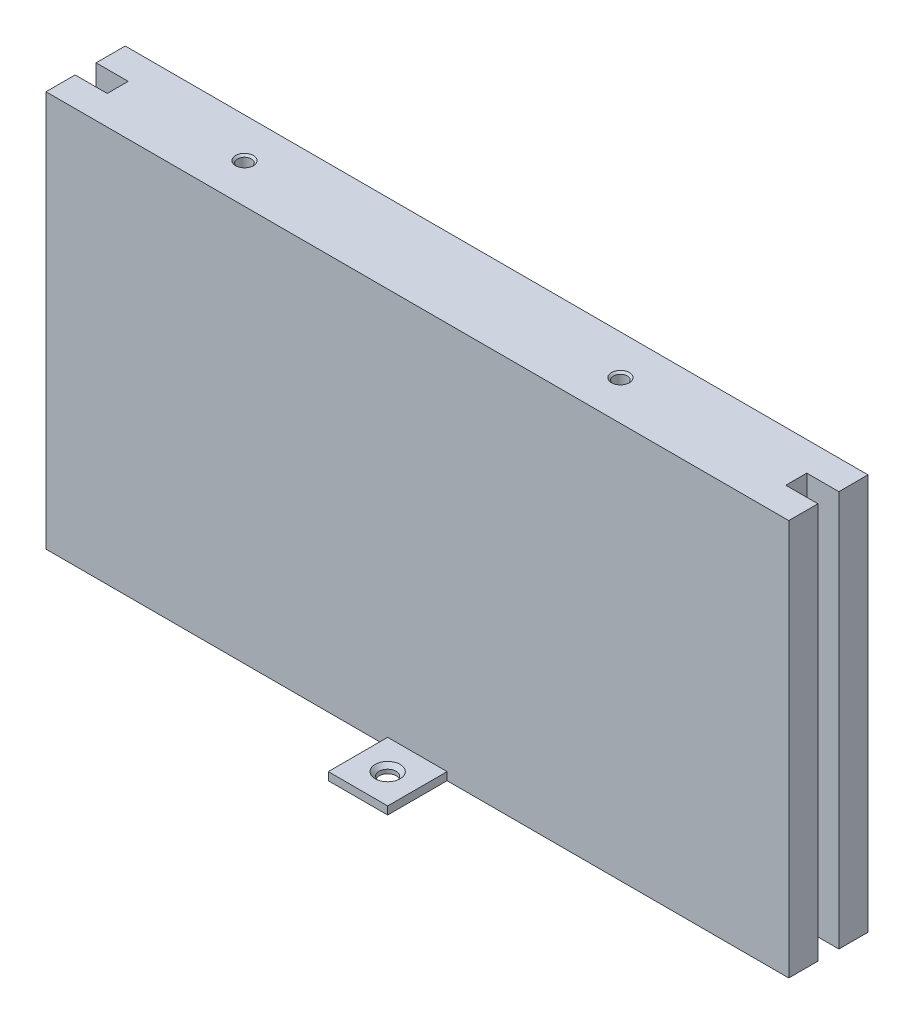
from build123d import *

# Parameters (mm, degrees)
SKETCH1_W           = 187.5
SKETCH1_H           = 20
BOSS_EXTRUDE1_DEPTH = 100
SKETCH2_W           = 8.1
SKETCH2_H           = 5.3
CUT_EXTRUDE1_DEPTH  = 100
SKETCH3_R           = 1.75
CUT_EXTRUDE2_DEPTH  = 8
CHAMFER1_SIZE       = 0.5
CHAMFER2_SIZE       = 0.5
SKETCH4_W           = 15
SKETCH4_H           = 2
BOSS_EXTRUDE2_DEPTH = 15
SKETCH5_W           = 15
SKETCH5_H           = 2
BOSS_EXTRUDE3_DEPTH = 15
SKETCH6_R           = 2.15
CUT_EXTRUDE3_DEPTH  = 15
CHAMFER3_SIZE       = 1


with BuildPart() as part:
    # Sketch1 → Boss-Extrude1 (new body)
    with BuildSketch(Plane(origin=(0, 0, 0), x_dir=(1, 0, 0), z_dir=(0, 1, 0))):
        with Locations((93.75, 10)):
            Rectangle(SKETCH1_W, SKETCH1_H)
    extrude(amount=BOSS_EXTRUDE1_DEPTH)

    # Sketch2 → Cut-Extrude1 (cut)
    with BuildSketch(Plane(origin=(0, 100, 0), x_dir=(1, 0, 0), z_dir=(0, 1, 0))):
        with Locations((4.05, 10)):
            Rectangle(SKETCH2_W, SKETCH2_H)
        with Locations((183.45, 10)):
            Rectangle(SKETCH2_W, SKETCH2_H)
    extrude(amount=-CUT_EXTRUDE1_DEPTH, mode=Mode.SUBTRACT)

    # Sketch3 → Cut-Extrude2 (cut)
    with BuildSketch(Plane(origin=(0, 100, 0), x_dir=(1, 0, 0), z_dir=(0, 1, 0))):
        with Locations(Location((40.1, 10, 0), (0, 0, 270))):
            Circle(SKETCH3_R)
        with Locations(Location((135, 10, 0), (0, 0, 270))):
            Circle(SKETCH3_R)
    extrude(amount=-CUT_EXTRUDE2_DEPTH, mode=Mode.SUBTRACT)

    # Chamfer1
    chamfer1_edges = [part.edges().sort_by_distance(p)[0] for p in [
        (40.1, 100, -11.75),
    ]]
    chamfer(chamfer1_edges, length=CHAMFER1_SIZE)

    # Chamfer2
    chamfer2_edges = [part.edges().sort_by_distance(p)[0] for p in [
        (135, 100, -11.75),
    ]]
    chamfer(chamfer2_edges, length=CHAMFER2_SIZE)

    # Sketch4 → Boss-Extrude2 (add)
    with BuildSketch(Plane(origin=(0, 0, -20), x_dir=(-1, 0, 0), z_dir=(0, 0, -1))):
        with Locations((-93.75, 1)):
            Rectangle(SKETCH4_W, SKETCH4_H)
    extrude(amount=BOSS_EXTRUDE2_DEPTH)

    # Sketch5 → Boss-Extrude3 (add)
    with BuildSketch(Plane.XY):
        with Locations((93.75, 1)):
            Rectangle(SKETCH5_W, SKETCH5_H)
    extrude(amount=BOSS_EXTRUDE3_DEPTH)

    # Sketch6 → Cut-Extrude3 (cut)
    with BuildSketch(Plane(origin=(0, 2, 0), x_dir=(1, 0, 0), z_dir=(0, 1, 0))):
        with Locations(Location((93.75, 27.5, 0), (0, 0, 180))):
            Circle(SKETCH6_R)
        with Locations(Location((93.75, -7.5, 0), (0, 0, 180))):
            Circle(SKETCH6_R)
    extrude(amount=-CUT_EXTRUDE3_DEPTH, mode=Mode.SUBTRACT)

    # Chamfer3
    chamfer3_edges = [part.edges().sort_by_distance(p)[0] for p in [
        (95.9, 2, -27.5),
        (95.9, 2, 7.5),
    ]]
    chamfer(chamfer3_edges, length=CHAMFER3_SIZE)


solid = part.part
